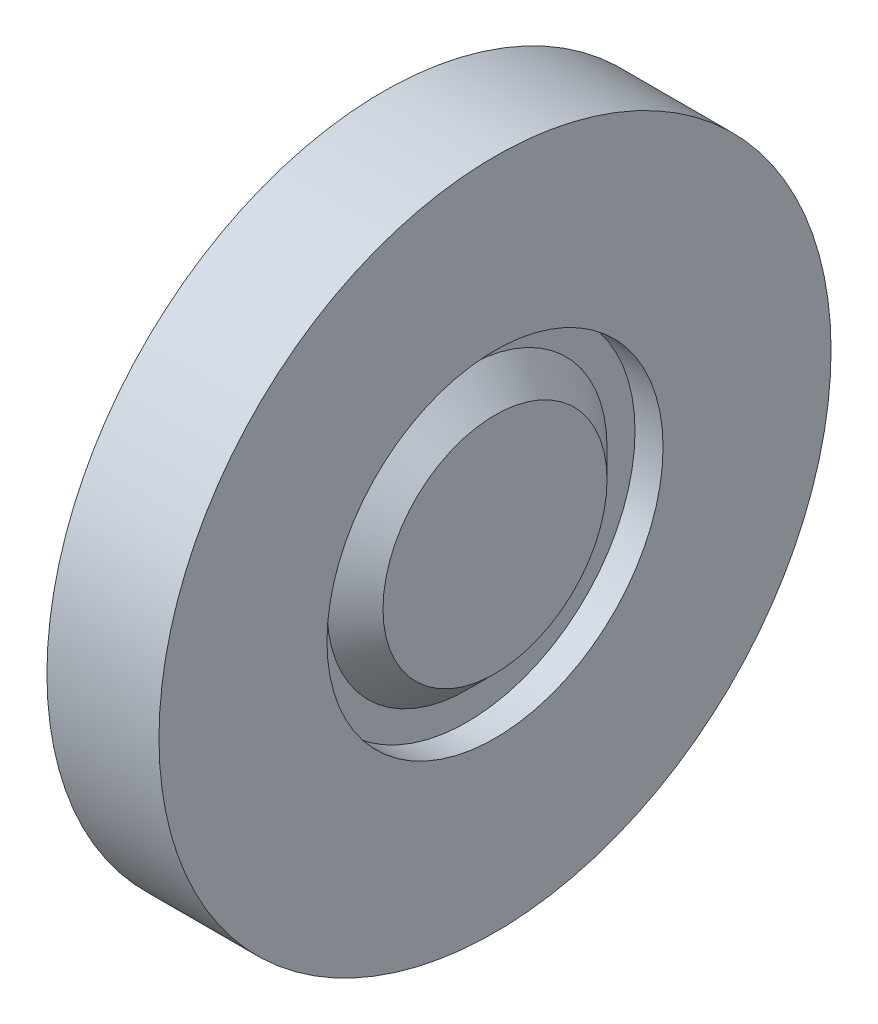
from build123d import *

# Parameters (mm, degrees)
SKETCH1_R           = 6
BOSS_EXTRUDE1_DEPTH = 2
SKETCH2_R           = 0.7
CUT_EXTRUDE1_DEPTH  = 0.5
SKETCH3_R           = 3
CUT_EXTRUDE2_DEPTH  = 0.5
SKETCH5_R           = 2
SKETCH4_R           = 2.5


with BuildPart() as part:
    # Sketch1 → Boss-Extrude1 (new body)
    with BuildSketch(Plane(origin=(0, 0, 0), x_dir=(0, 0, -1), z_dir=(1, 0, 0))):
        Circle(SKETCH1_R)
    extrude(amount=BOSS_EXTRUDE1_DEPTH)

    # Sketch2 → Cut-Extrude1 (cut)
    with BuildSketch(Plane.ZY):
        Circle(SKETCH2_R)
    extrude(amount=-CUT_EXTRUDE1_DEPTH, mode=Mode.SUBTRACT)

    # Sketch3 → Cut-Extrude2 (cut)
    with BuildSketch(Plane(origin=(2, 0, 0), x_dir=(0, 0, -1), z_dir=(1, 0, 0))):
        Circle(SKETCH3_R)
    extrude(amount=-CUT_EXTRUDE2_DEPTH, mode=Mode.SUBTRACT)

    # Sketch5 → Loft1 section 0
    with BuildSketch(Plane(origin=(2, 0, 0), x_dir=(0, 0, -1), z_dir=(1, 0, 0))):
        Circle(SKETCH5_R)
    # Sketch4 → Loft1 section 1
    with BuildSketch(Plane(origin=(1.5, 0, 0), x_dir=(0, 0, -1), z_dir=(1, 0, 0))):
        Circle(SKETCH4_R)
    loft()


solid = part.part
